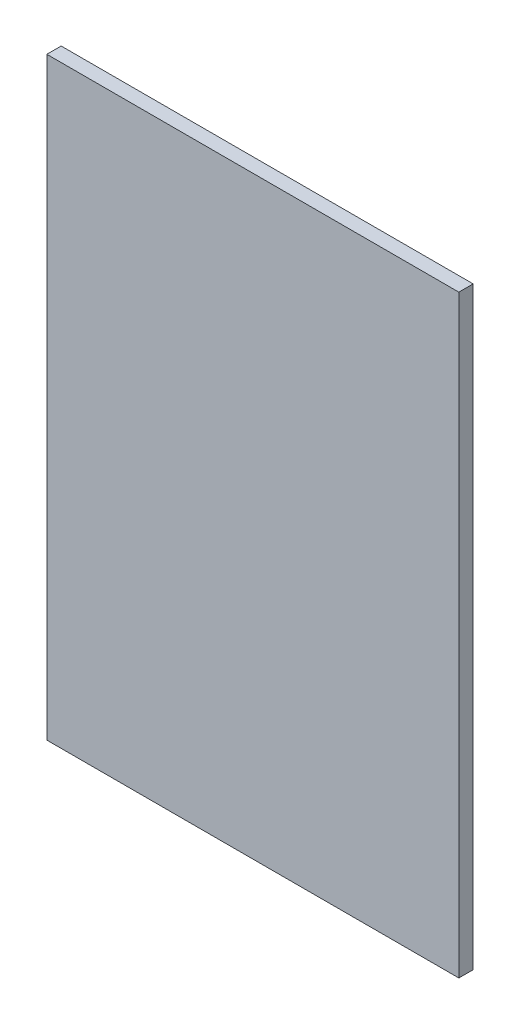
from build123d import *

# Parameters (mm, degrees)
SKETCH1_W           = 489
SKETCH1_H           = 705
BOSS_EXTRUDE1_DEPTH = 17


with BuildPart() as part:
    # Sketch1 → Boss-Extrude1 (new body)
    with BuildSketch(Plane.XY):
        with Locations((244.5, -380.5)):
            Rectangle(SKETCH1_W, SKETCH1_H)
    extrude(amount=BOSS_EXTRUDE1_DEPTH)


solid = part.part
